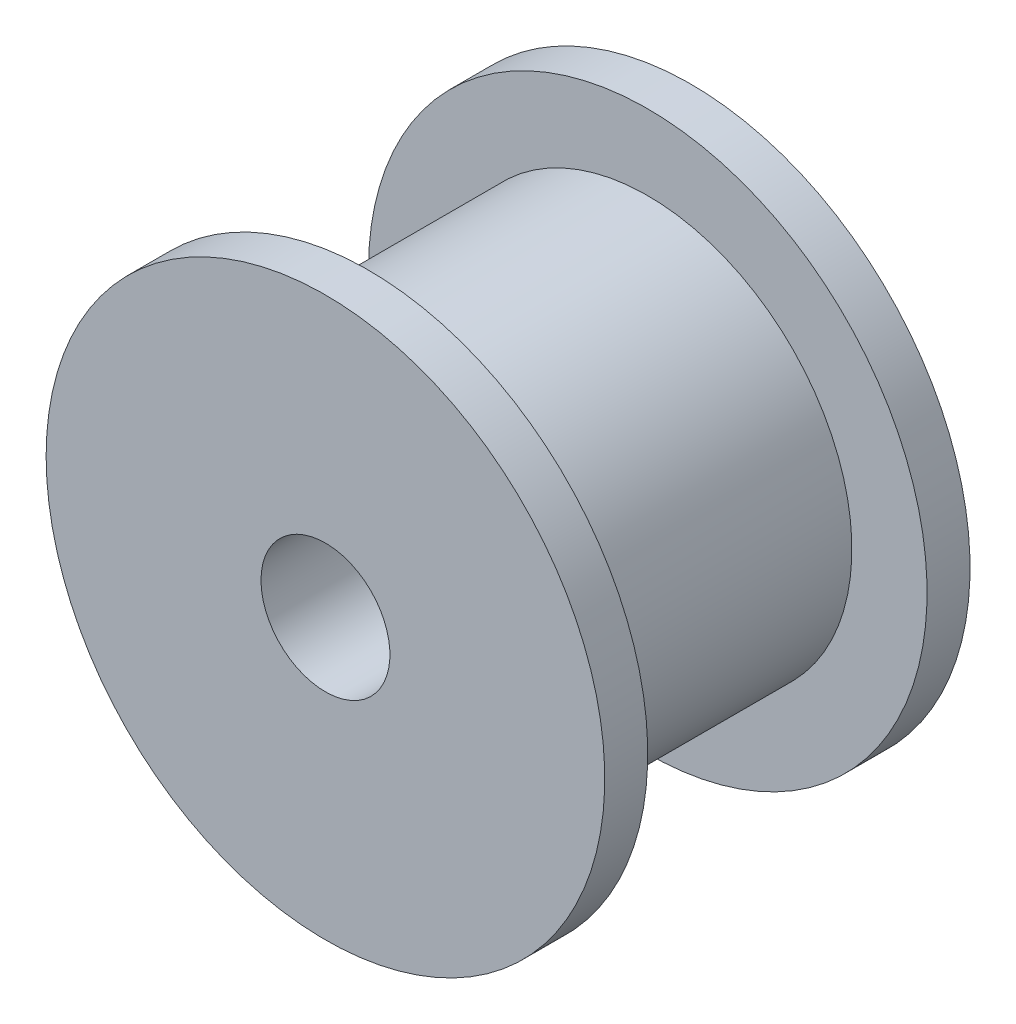
from build123d import *


with BuildPart() as part:
    # Sketch2 → Revolve1 (revolve)
    with BuildSketch(Plane(origin=(0, 0, 0), x_dir=(-1, 0, 0), z_dir=(0, 1, 0)), mode=Mode.PRIVATE) as revolve1_sk:
        Polygon((-6.5, 3.25), (-6.5, -3.25), (-8.25, -3.25), (-8.25, -4.25), (-3.25, -4.25), (-3.25, 4.25), (-8.25, 4.25), (-8.25, 3.25), align=None)
    revolve(revolve1_sk.sketch.rotate(Axis((1.75, 0, -3.25), (0, 0, 1)), 180), axis=Axis((1.75, 0, -3.25), (0, 0, 1)))


solid = part.part
